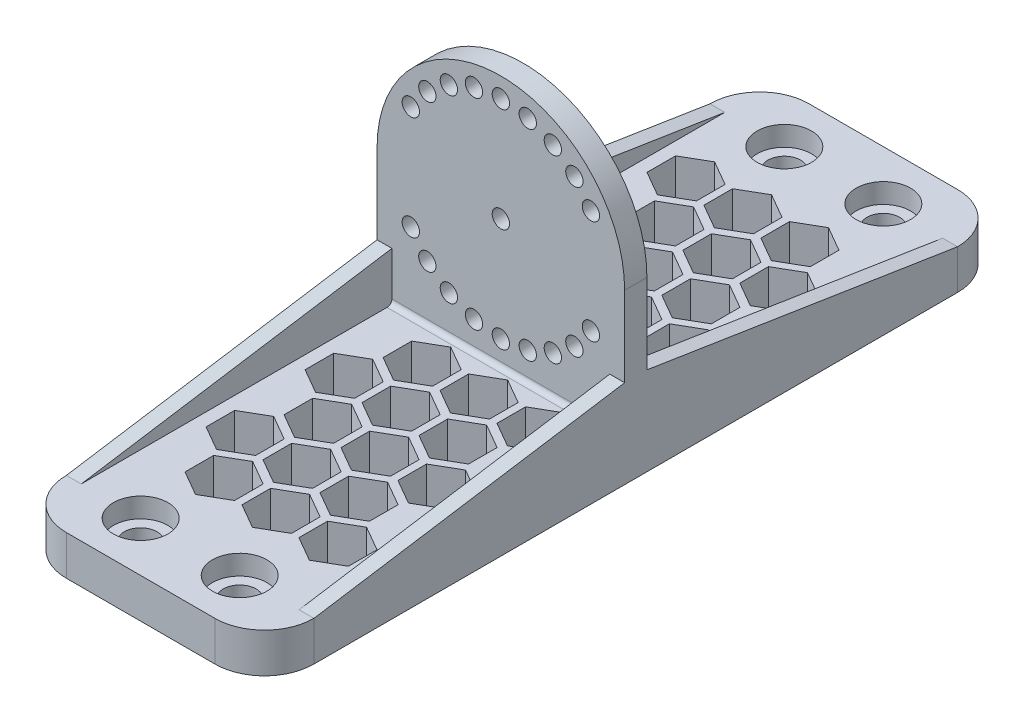
from build123d import *

# Parameters (mm, degrees)
SKETCH_1_W                  = 50
SKETCH_1_H                  = 150
EXTRUDE_1_DEPTH             = 8
SKETCH_2_R                  = 1.75
EXTRUDE_2_DEPTH             = 2.25
CUT_EXTRUDE_1_DEPTH         = 99.645831133
CUT_EXTRUDE_1_DEPTH_BACK    = 99.645831133
SKETCH_5_R                  = 1.75
CUT_EXTRUDE_3_DEPTH         = 99.645831133
CUT_EXTRUDE_3_DEPTH_BACK    = 5
SKETCH_6_R                  = 3.3
FILLET_1_R                  = 10
SKETCH_8_R                  = 5.5
CUT_EXTRUDE_5_DEPTH         = 4
EXTRUDE_3_DEPTH             = 3
EXTRUDE_4_DEPTH             = 3
FILLET_2_R                  = 1
CUT_EXTRUDE_7_DEPTH         = 10
PATTERN_LINEAR_2_COUNT      = 5
PATTERN_LINEAR_2_PITCH      = 10
PATTERN_LINEAR_2_COUNT_DIR2 = 6
PATTERN_LINEAR_2_PITCH_DIR2 = 5.75
CUT_EXTRUDE_8_DEPTH         = 10
PATTERN_LINEAR_3_COUNT      = 5
PATTERN_LINEAR_3_PITCH      = 10
PATTERN_LINEAR_3_COUNT_DIR2 = 6
PATTERN_LINEAR_3_PITCH_DIR2 = 5.75


with BuildPart() as part:
    # ｽｹｯﾁ1 → ﾎﾞｽ - 押し出し1 (new body)
    with BuildSketch(Plane(origin=(0, 0, 0), x_dir=(1, 0, 0), z_dir=(0, 1, 0))):
        Rectangle(SKETCH_1_W, SKETCH_1_H)
    extrude(amount=EXTRUDE_1_DEPTH)

    # ｽｹｯﾁ2 → ﾎﾞｽ - 押し出し2 (add, symmetric)
    with BuildSketch(Plane.XY):
        with BuildLine():
            Line((25, 8), (-25, 8))
            Line((-25, 8), (-25, 34))
            ThreePointArc((-25, 34), (0, 59), (25, 34))
            Line((25, 34), (25, 8))
        make_face()
        with Locations((0, 34)):
            Circle(SKETCH_2_R, mode=Mode.SUBTRACT)
    extrude(amount=EXTRUDE_2_DEPTH, both=True)

    # ｽｹｯﾁ5 → ｶｯﾄ - 押し出し1 (cut, two sides: drawn at the far end of the back side and taken through both)
    with BuildSketch(Plane.XY.offset(-CUT_EXTRUDE_1_DEPTH_BACK)):
        with Locations((0, 55)):
            Circle(SKETCH_5_R)
        with Locations((5.435199947, 54.284442352)):
            Circle(SKETCH_5_R)
        with Locations((10.5, 52.186533479)):
            Circle(SKETCH_5_R)
        with Locations((14.849242405, 48.849242405)):
            Circle(SKETCH_5_R)
        with Locations((18.186533479, 44.5)):
            Circle(SKETCH_5_R)
        with Locations((18.186533479, 23.5)):
            Circle(SKETCH_5_R)
        with Locations((14.849242405, 19.150757595)):
            Circle(SKETCH_5_R)
        with Locations((10.5, 15.813466521)):
            Circle(SKETCH_5_R)
        with Locations((5.435199947, 13.715557648)):
            Circle(SKETCH_5_R)
        with Locations((0, 13)):
            Circle(SKETCH_5_R)
        with Locations((-5.435199947, 13.715557648)):
            Circle(SKETCH_5_R)
        with Locations((-10.5, 15.813466521)):
            Circle(SKETCH_5_R)
        with Locations((-14.849242405, 19.150757595)):
            Circle(SKETCH_5_R)
        with Locations((-18.186533479, 23.5)):
            Circle(SKETCH_5_R)
        with Locations((-18.186533479, 44.5)):
            Circle(SKETCH_5_R)
        with Locations((-14.849242405, 48.849242405)):
            Circle(SKETCH_5_R)
        with Locations((-10.5, 52.186533479)):
            Circle(SKETCH_5_R)
        with Locations((-5.435199947, 54.284442352)):
            Circle(SKETCH_5_R)
    extrude(amount=CUT_EXTRUDE_1_DEPTH + CUT_EXTRUDE_1_DEPTH_BACK, mode=Mode.SUBTRACT)

    # ｽｹｯﾁ6 → ｶｯﾄ - 押し出し3 (cut, two sides: drawn at the far end of the back side and taken through both)
    with BuildSketch(Plane(origin=(0, 0, 0), x_dir=(1, 0, 0), z_dir=(0, 1, 0)).offset(-CUT_EXTRUDE_3_DEPTH_BACK)):
        with Locations(Location((-10, -65, 0), (0, 0, 90))):
            Circle(SKETCH_6_R)
        with Locations(Location((10, -65, 0), (0, 0, 90))):
            Circle(SKETCH_6_R)
        with Locations(Location((10, 65, 0), (0, 0, 90))):
            Circle(SKETCH_6_R)
        with Locations(Location((-10, 65, 0), (0, 0, 90))):
            Circle(SKETCH_6_R)
    extrude(amount=CUT_EXTRUDE_3_DEPTH + CUT_EXTRUDE_3_DEPTH_BACK, mode=Mode.SUBTRACT)

    # ﾌｨﾚｯﾄ1
    fillet_1_edges = [part.edges().sort_by_distance(p)[0] for p in [
        (-25, 4, 75),
        (-25, 4, -75),
        (25, 4, -75),
        (25, 4, 75),
    ]]
    fillet(fillet_1_edges, radius=FILLET_1_R)

    # ｽｹｯﾁ8 → ｶｯﾄ - 押し出し5 (cut)
    with BuildSketch(Plane(origin=(0, 8, 0), x_dir=(1, 0, 0), z_dir=(0, 1, 0))):
        with Locations(Location((-10, -65, 0), (0, 0, 270))):
            Circle(SKETCH_8_R)
        with Locations(Location((10, -65, 0), (0, 0, 90))):
            Circle(SKETCH_8_R)
        with Locations(Location((10, 65, 0), (0, 0, 270))):
            Circle(SKETCH_8_R)
        with Locations(Location((-10, 65, 0), (0, 0, 90))):
            Circle(SKETCH_8_R)
    extrude(amount=-CUT_EXTRUDE_5_DEPTH, mode=Mode.SUBTRACT)

    # ｽｹｯﾁ11 → ﾎﾞｽ - 押し出し3 (add)
    with BuildSketch(Plane(origin=(25, 0, 0), x_dir=(0, 0, -1), z_dir=(1, 0, 0))):
        Polygon((-2.25, 17.834192463), (-65, 8), (-2.25, 8), align=None)
        Polygon((65, 8), (2.25, 8), (2.25, 17.834192463), align=None)
    extrude(amount=-EXTRUDE_3_DEPTH)

    # ｽｹｯﾁ12 → ﾎﾞｽ - 押し出し4 (add)
    with BuildSketch(Plane.ZY.offset(25)):
        Polygon((2.25, 17.834192463), (65, 8), (2.25, 8), align=None)
        Polygon((-2.25, 17.834192463), (-65, 8), (-2.25, 8), align=None)
    extrude(amount=-EXTRUDE_4_DEPTH)

    # ﾌｨﾚｯﾄ2
    fillet_2_edges = [part.edges().sort_by_distance(p)[0] for p in [
        (0, 8, 2.25),
        (0, 8, -2.25),
    ]]
    fillet(fillet_2_edges, radius=FILLET_2_R)

    # ｽｹｯﾁ14 → ｶｯﾄ - 押し出し7 (cut)
    with BuildSketch(Plane(origin=(0, 8, 0), x_dir=(1, 0, 0), z_dir=(0, 1, 0))):
        Polygon((-14.375, 3.75), (-9.375, 6.636751346), (-9.375, 12.410254038), (-14.375, 15.297005384), (-19.375, 12.410254038), (-19.375, 6.636751346), align=None)
    cut_extrude_7 = extrude(amount=-CUT_EXTRUDE_7_DEPTH, mode=Mode.SUBTRACT)

    # 直線ﾊﾟﾀｰﾝ2: Cut-Extrude 7 5 × 6, 15 skipped
    with Locations(*[(j * PATTERN_LINEAR_2_PITCH_DIR2, 0, -i * PATTERN_LINEAR_2_PITCH) for i in range(PATTERN_LINEAR_2_COUNT) for j in range(PATTERN_LINEAR_2_COUNT_DIR2) if (i, j) not in ((0, 0), (0, 1), (0, 3), (0, 5), (1, 0), (1, 2), (1, 4), (2, 1), (2, 3), (2, 5), (3, 0), (3, 2), (3, 4), (4, 1), (4, 3), (4, 5))]):
        add(cut_extrude_7, mode=Mode.SUBTRACT)

    # ｽｹｯﾁ15 → ｶｯﾄ - 押し出し8 (cut)
    with BuildSketch(Plane(origin=(0, 8, 0), x_dir=(1, 0, 0), z_dir=(0, 1, 0))):
        Polygon((14.375, -15.297005384), (19.375, -12.410254038), (19.375, -6.636751346), (14.375, -3.75), (9.375, -6.636751346), (9.375, -12.410254038), align=None)
    cut_extrude_8 = extrude(amount=-CUT_EXTRUDE_8_DEPTH, mode=Mode.SUBTRACT)

    # 直線ﾊﾟﾀｰﾝ3: Cut-Extrude 8 5 × 6, 15 skipped
    with Locations(*[(-j * PATTERN_LINEAR_3_PITCH_DIR2, 0, i * PATTERN_LINEAR_3_PITCH) for i in range(PATTERN_LINEAR_3_COUNT) for j in range(PATTERN_LINEAR_3_COUNT_DIR2) if (i, j) not in ((0, 0), (0, 1), (0, 3), (0, 5), (1, 0), (1, 2), (1, 4), (2, 1), (2, 3), (2, 5), (3, 0), (3, 2), (3, 4), (4, 1), (4, 3), (4, 5))]):
        add(cut_extrude_8, mode=Mode.SUBTRACT)


solid = part.part
